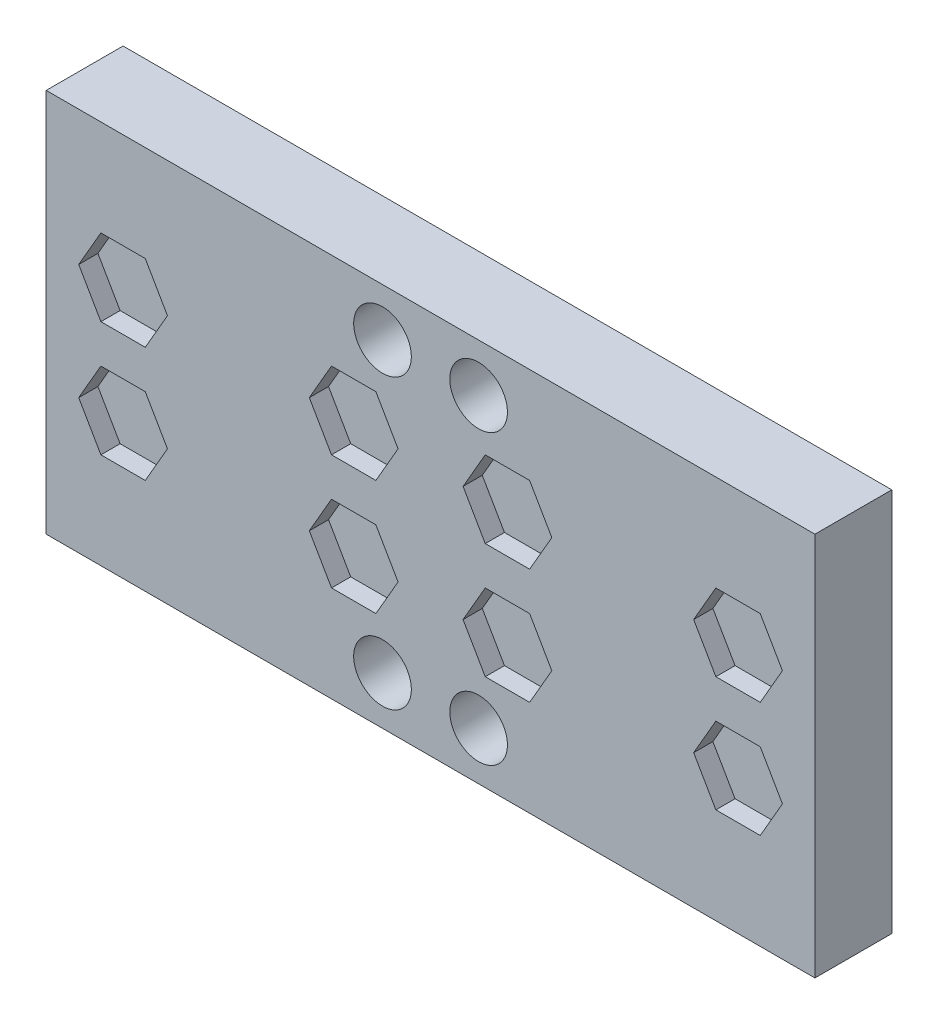
from build123d import *

# Parameters (mm, degrees)
SKETCH1_W           = 100
SKETCH1_H           = 50
SKETCH1_R           = 7.5
BOSS_EXTRUDE1_DEPTH = 10
CUT_EXTRUDE1_DEPTH  = 5


with BuildPart() as part:
    # Sketch1 → Boss-Extrude1 (new body)
    with BuildSketch(Plane.XY):
        with Locations((50, 25)):
            Rectangle(SKETCH1_W, SKETCH1_H)
        with Locations((87.5, 37.5)):
            Circle(SKETCH1_R, mode=Mode.SUBTRACT)
    extrude(amount=BOSS_EXTRUDE1_DEPTH)

    # Sketch2 → Cut-Extrude1 (cut)
    with BuildSketch(Plane.XY.offset(10)):
        Polygon((25.773502692, 25), (14.226497308, 25), (8.452994616, 15), (14.226497308, 5), (25.773502692, 5), (31.547005384, 15), align=None)
    cut_extrude1 = extrude(amount=-CUT_EXTRUDE1_DEPTH, mode=Mode.SUBTRACT)

    # Mirror1: Cut-Extrude1 across plane
    add(cut_extrude1.mirror(Plane.ZY.offset(-50)), mode=Mode.SUBTRACT)

    # Mirror3: part across plane


with BuildPart() as part_1:
    add(part.part)
    add(part.part.mirror(Plane(origin=(0, 0, 10), x_dir=(0, 0, 1), z_dir=(0, 1, 0))))

    # Mirror4: part across plane


with BuildPart() as part_2:
    add(part_1.part)
    add(part_1.part.mirror(Plane(origin=(100, 0, 10), x_dir=(0, 0, 1), z_dir=(-1, 0, 0))))

    # Mirror5: part across plane


with BuildPart() as part_3:
    add(part_2.part)
    add(part_2.part.mirror(Plane(origin=(0, 0, 0), x_dir=(1, 0, 0), z_dir=(0, 0, -1))))


solid = part_3.part
